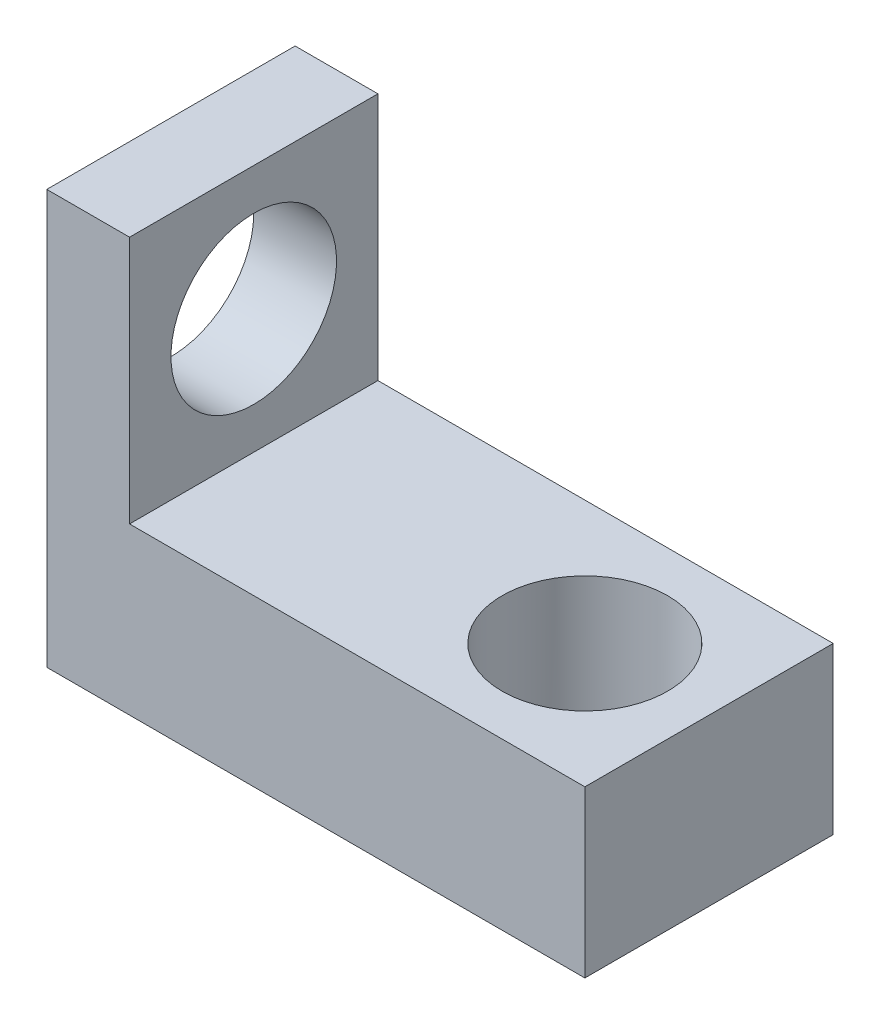
from build123d import *

# Parameters (mm, degrees)
BOSS_EXTRUDE3_DEPTH = 30
SKETCH6_R           = 10
CUT_EXTRUDE2_DEPTH  = 30
SKETCH7_R           = 10
CUT_EXTRUDE3_DEPTH  = 30


with BuildPart() as part:
    # Sketch5 → Boss-Extrude3 (new body)
    with BuildSketch(Plane.XY):
        Polygon((0, 0), (0, 50), (10, 50), (10, 20), (65, 20), (65, 0), align=None)
    extrude(amount=-BOSS_EXTRUDE3_DEPTH)

    # Sketch6 → Cut-Extrude2 (cut)
    with BuildSketch(Plane(origin=(0, 20, 0), x_dir=(1, 0, 0), z_dir=(0, 1, 0))):
        with Locations(Location((50, 15, 0), (0, 0, 270))):
            Circle(SKETCH6_R)
    extrude(amount=-CUT_EXTRUDE2_DEPTH, mode=Mode.SUBTRACT)

    # Sketch7 → Cut-Extrude3 (cut)
    with BuildSketch(Plane(origin=(10, 0, 0), x_dir=(0, 0, -1), z_dir=(1, 0, 0))):
        with Locations(Location((15, 35, 0), (0, 0, 90))):
            Circle(SKETCH7_R)
    extrude(amount=-CUT_EXTRUDE3_DEPTH, mode=Mode.SUBTRACT)


solid = part.part
